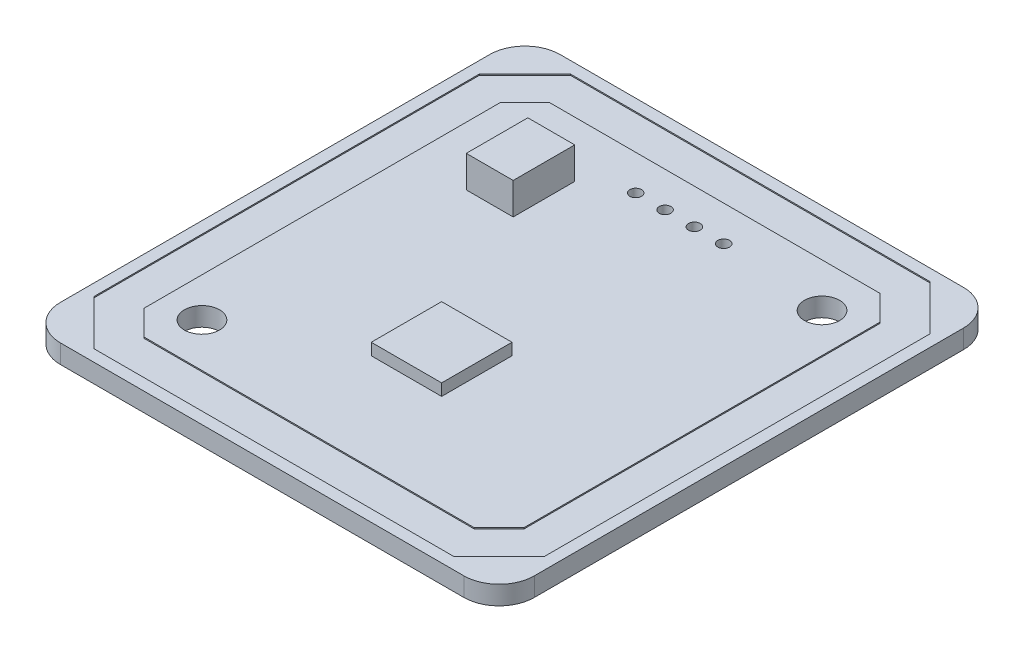
from build123d import *

# Parameters (mm, degrees)
SKETCH1_W               = 40.4
SKETCH1_H               = 42.6
BOSS_EXTRUDE1_DEPTH     = 1.6
SKETCH2_R               = 1.5
CUT_EXTRUDE1_DEPTH      = 30.3988095
CUT_EXTRUDE_THIN2_DEPTH = 0.1
FILLET1_R               = 3
SKETCH3_W               = 4
SKETCH3_H               = 5.25
BOSS_EXTRUDE2_DEPTH     = 2.7
SKETCH4_W               = 6
SKETCH4_H               = 6
BOSS_EXTRUDE3_DEPTH     = 1
SKETCH6_R               = 0.5
CUT_EXTRUDE2_DEPTH      = 30.479145171


with BuildPart() as part:
    # Sketch1 → Boss-Extrude1 (new body)
    with BuildSketch(Plane(origin=(0, 0, 0), x_dir=(1, 0, 0), z_dir=(0, 1, 0))):
        Rectangle(SKETCH1_W, SKETCH1_H)
    extrude(amount=BOSS_EXTRUDE1_DEPTH)

    # Sketch2 → Cut-Extrude1 (cut, through all)
    with BuildSketch(Plane(origin=(0, 1.6, 0), x_dir=(1, 0, 0), z_dir=(0, 1, 0))):
        with Locations((12.867890888, 13.568617619)):
            Circle(SKETCH2_R)
        with Locations((-12.867890888, -13.568617619)):
            Circle(SKETCH2_R)
    extrude(amount=-CUT_EXTRUDE1_DEPTH, mode=Mode.SUBTRACT)

    # Sketch5 → Cut-Extrude-Thin2 (cut)
    with BuildSketch(Plane(origin=(0, 1.6, 0), x_dir=(1, 0, 0), z_dir=(0, 1, 0))):
        Polygon((-15.321320344, 20.3), (-19.2, 16.421320344), (-19.2, -16.421320344), (-15.321320344, -20.3), (15.321320344, -20.3), (19.2, -16.421320344), (19.2, 16.421320344), (15.321320344, 20.3), align=None)
        Polygon((-14.078679656, 17.3), (-16.2, 15.178679656), (-16.2, -15.178679656), (-14.078679656, -17.3), (14.078679656, -17.3), (16.2, -15.178679656), (16.2, 15.178679656), (14.078679656, 17.3), align=None, mode=Mode.SUBTRACT)
    extrude(amount=-CUT_EXTRUDE_THIN2_DEPTH, mode=Mode.SUBTRACT)

    # Fillet1
    fillet1_edges = [part.edges().sort_by_distance(p)[0] for p in [
        (20.2, 0.8, -21.3),
        (20.2, 0.8, 21.3),
        (-20.2, 0.8, 21.3),
        (-20.2, 0.8, -21.3),
    ]]
    fillet(fillet1_edges, radius=FILLET1_R)

    # Sketch3 → Boss-Extrude2 (add)
    with BuildSketch(Plane(origin=(0, 1.6, 0), x_dir=(1, 0, 0), z_dir=(0, 1, 0))):
        with Locations((-9.2, 9.925)):
            Rectangle(SKETCH3_W, SKETCH3_H)
    extrude(amount=BOSS_EXTRUDE2_DEPTH)

    # Sketch4 → Boss-Extrude3 (add)
    with BuildSketch(Plane(origin=(0, 1.6, 0), x_dir=(1, 0, 0), z_dir=(0, 1, 0))):
        with Locations((0, -6)):
            Rectangle(SKETCH4_W, SKETCH4_H)
    extrude(amount=BOSS_EXTRUDE3_DEPTH)

    # Sketch6 → Cut-Extrude2 (cut, through all)
    with BuildSketch(Plane(origin=(0, 1.6, 0), x_dir=(1, 0, 0), z_dir=(0, 1, 0))):
        with Locations((-3.75, 14.3)):
            Circle(SKETCH6_R)
        with Locations((-1.25, 14.3)):
            Circle(SKETCH6_R)
        with Locations((1.25, 14.3)):
            Circle(SKETCH6_R)
        with Locations((3.75, 14.3)):
            Circle(SKETCH6_R)
    extrude(amount=-CUT_EXTRUDE2_DEPTH, mode=Mode.SUBTRACT)


solid = part.part
